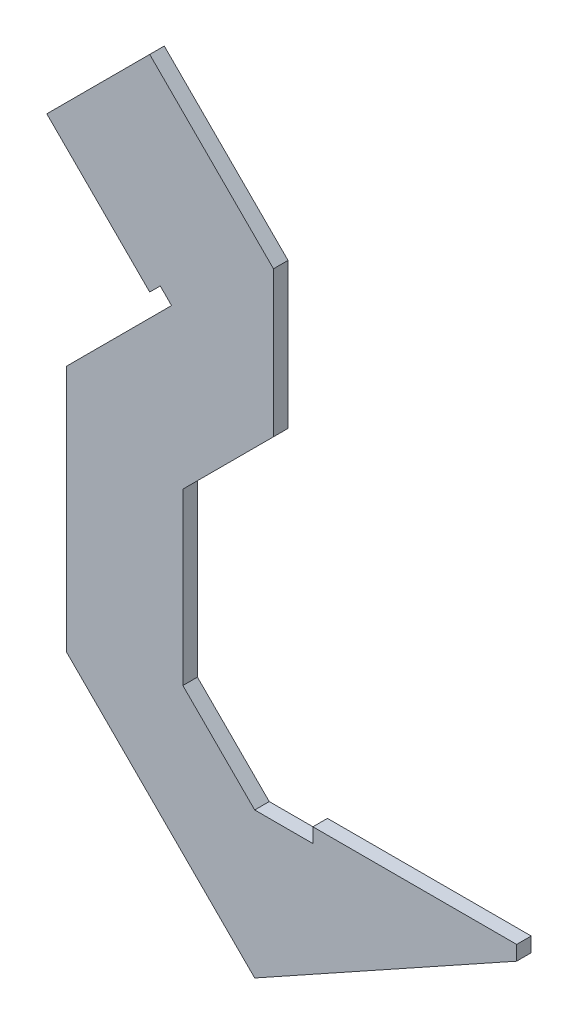
from build123d import *

# Parameters (mm, degrees)
BOSS_EXTRUDE1_DEPTH = 0.05


with BuildPart() as part:
    # Sketch1 → Boss-Extrude1 (new, symmetric)
    with BuildSketch(Plane.XY):
        Polygon((0, 0), (-1.4, 0), (-1.4, -0.1), (-1.8, -0.1), (-2.293725624, 0.393725624), (-2.293725624, 1.562470542), (-1.670991302, 2.185204865), (-1.670991302, 3.185204865), (-2.521542086, 4.035755648), (-3.228648867, 3.328648867), (-2.521542086, 2.621542086), (-2.449038167, 2.694046004), (-2.37127959, 2.616287427), (-3.093725624, 1.893841392), (-3.093725624, 0.193725624), (-1.8, -1.1), (0, -0.1), align=None)
    extrude(amount=BOSS_EXTRUDE1_DEPTH, both=True)


solid = part.part
